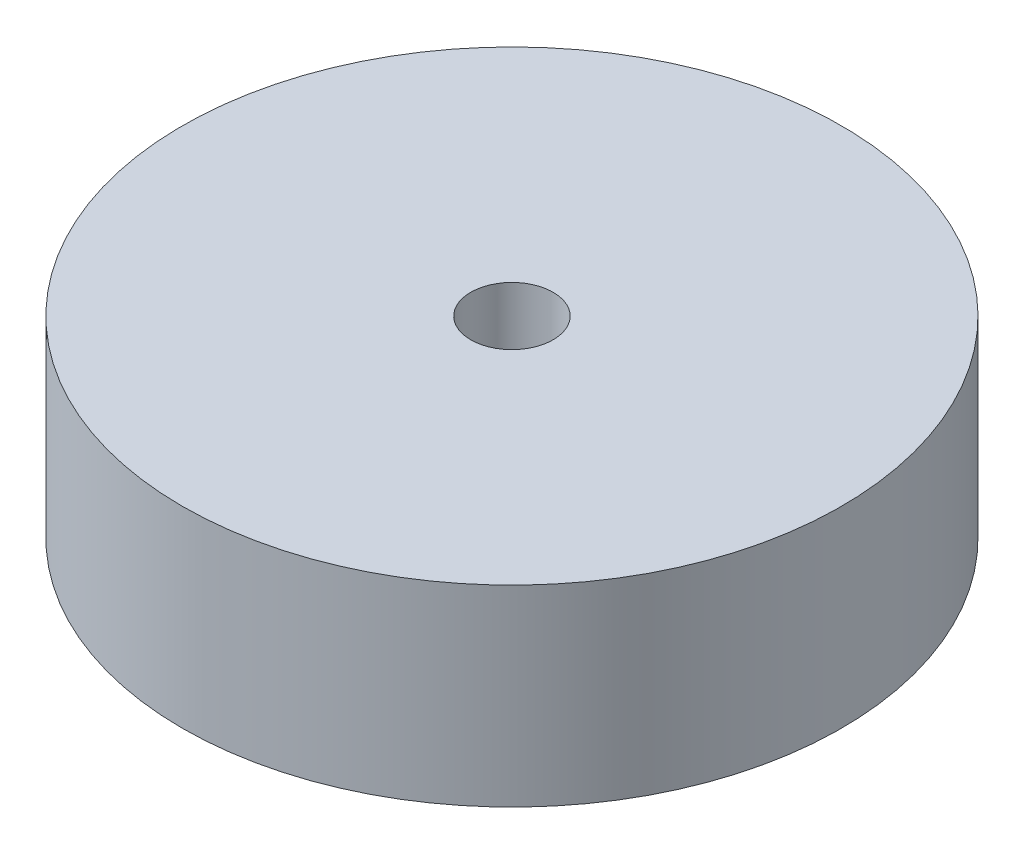
from build123d import *


with BuildPart() as part:
    # Main Shape Profile → Main Shape (revolve)
    with BuildSketch(Plane.XY, mode=Mode.PRIVATE) as main_shape_sk:
        Polygon((9.525, 44.45), (9.525, 25.4), (31.75, 25.4), (31.75, 15.24), (38.1, 15.24), (38.1, 8.89), (57.15, 8.89), (57.15, 0), (76.2, 0), (76.2, 44.45), align=None)
    revolve(main_shape_sk.sketch.rotate(Axis((0, 0, 0), (0, -1, 0)), 90), axis=Axis((0, 0, 0), (0, -1, 0)))


solid = part.part
